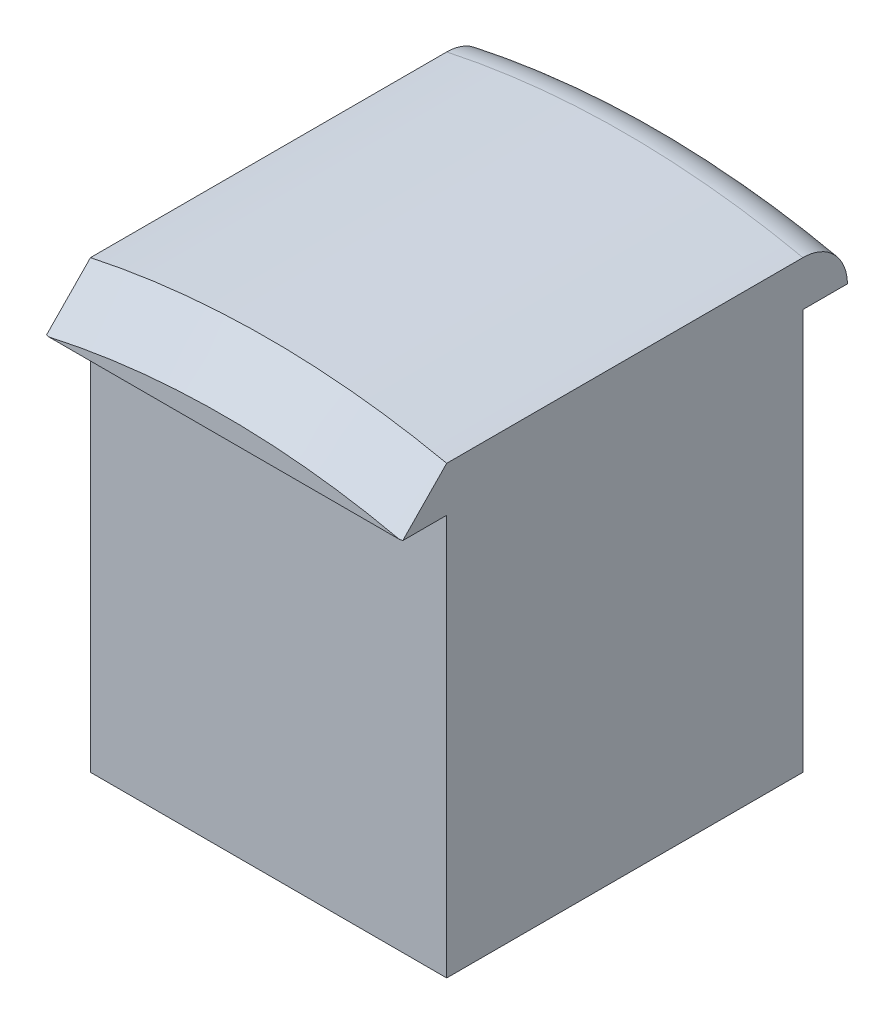
from build123d import *

# Parameters (mm, degrees)
SALIENTE_EXTRUIR1_DEPTH = 50
CROQUIS4_W              = 5
CROQUIS4_H              = 45
CORTAR_EXTRUIR3_DEPTH   = 50
CROQUIS5_W              = 36
CROQUIS5_H              = 43
CORTAR_EXTRUIR4_DEPTH   = 38
REDONDEO1_R             = 5
CHAFL_N1_SIZE           = 5


with BuildPart() as part:
    # Croquis1 → Saliente-Extruir1 (new body)
    with BuildSketch(Plane.XY):
        with BuildLine():
            Line((-50.7945892, 126.897083669), (-50.7945892, 121.077719464))
            Line((-50.7945892, 121.077719464), (-50.7945892, 76.846205564))
            Line((-50.7945892, 76.846205564), (-10.7945892, 76.846205564))
            Line((-10.7945892, 76.846205564), (-10.7945892, 121.077719464))
            Line((-10.7945892, 121.077719464), (-10.7945892, 126.897083669))
            ThreePointArc((-10.7945892, 126.897083669), (-30.7945892, 129.026205564), (-50.7945892, 126.897083669))
        make_face()
    extrude(amount=SALIENTE_EXTRUIR1_DEPTH)

    # Croquis4 → Cortar-Extruir3 (cut)
    with BuildSketch(Plane.ZY.offset(50.7945892)):
        with Locations((2.5, 99.346205564)):
            Rectangle(CROQUIS4_W, CROQUIS4_H)
        with Locations((47.5, 99.346205564)):
            Rectangle(CROQUIS4_W, CROQUIS4_H)
    extrude(amount=-CORTAR_EXTRUIR3_DEPTH, mode=Mode.SUBTRACT)

    # Croquis5 → Cortar-Extruir4 (cut)
    with BuildSketch(Plane(origin=(0, 0, 5), x_dir=(-1, 0, 0), z_dir=(0, 0, -1))):
        with Locations((30.7945892, 100.346205564)):
            Rectangle(CROQUIS5_W, CROQUIS5_H)
    extrude(amount=-CORTAR_EXTRUIR4_DEPTH, mode=Mode.SUBTRACT)

    # Redondeo1
    redondeo1_edges = [part.edges().sort_by_distance(p)[0] for p in [
        (-30.7945892, 129.026205564, 0),
    ]]
    fillet(redondeo1_edges, radius=REDONDEO1_R)

    # Chaflán1
    chafl_n1_edges = [part.edges().sort_by_distance(p)[0] for p in [
        (-30.7945892, 129.026205564, 50),
    ]]
    chamfer(chafl_n1_edges, length=CHAFL_N1_SIZE)


solid = part.part
